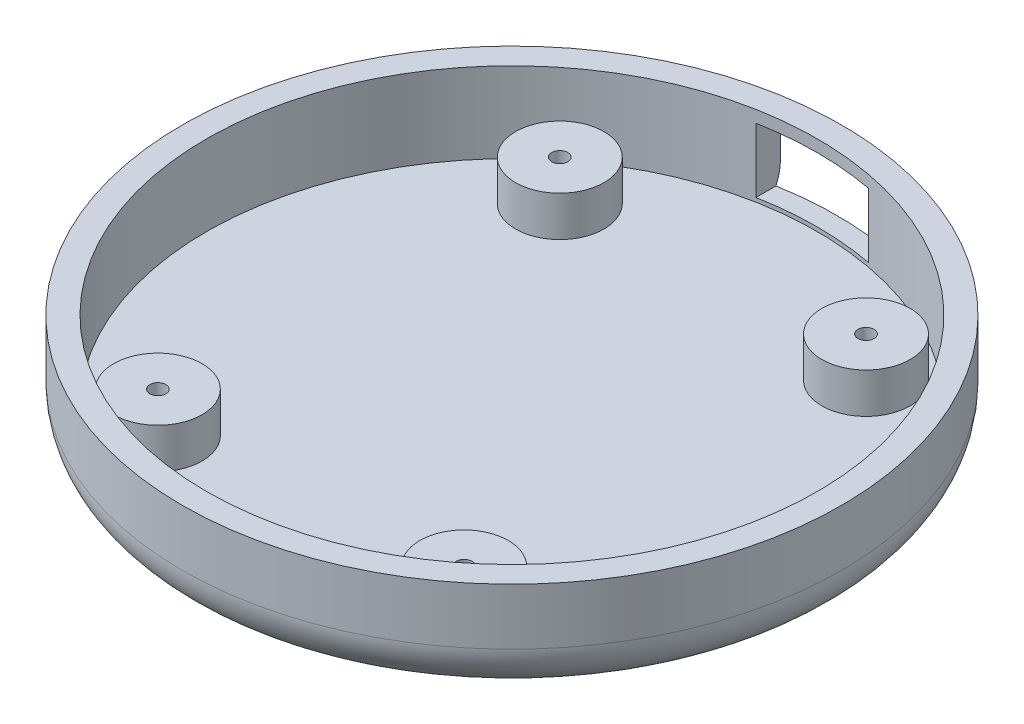
from build123d import *

# Parameters (mm, degrees)
SKETCH1_R           = 41
SKETCH1_R_2         = 2.5
BOSS_EXTRUDE1_DEPTH = 3
SKETCH3_R           = 41
SKETCH3_R_2         = 38
BOSS_EXTRUDE2_DEPTH = 10
SKETCH3_3_R         = 5.5
SKETCH3_3_R_2       = 2.5
BOSS_EXTRUDE3_DEPTH = 3
SKETCH4_R           = 5.5
SKETCH4_R_2         = 1
BOSS_EXTRUDE4_DEPTH = 2
FILLET1_R           = 6
SKETCH6_W           = 14
SKETCH6_H           = 8
CUT_EXTRUDE1_DEPTH  = 60.422218067


with BuildPart() as part:
    # Sketch1 → Boss-Extrude1 (new body)
    with BuildSketch(Plane(origin=(0, 0, 0), x_dir=(1, 0, 0), z_dir=(0, 1, 0))):
        Circle(SKETCH1_R)
        with Locations((-19.05, 25)):
            Circle(SKETCH1_R_2, mode=Mode.SUBTRACT)
        with Locations((19.05, 25)):
            Circle(SKETCH1_R_2, mode=Mode.SUBTRACT)
        with Locations((19.05, -25)):
            Circle(SKETCH1_R_2, mode=Mode.SUBTRACT)
        with Locations((-19.05, -25)):
            Circle(SKETCH1_R_2, mode=Mode.SUBTRACT)
    extrude(amount=BOSS_EXTRUDE1_DEPTH)

    # Sketch3 → Boss-Extrude2 (add)
    with BuildSketch(Plane(origin=(0, 3, 0), x_dir=(1, 0, 0), z_dir=(0, 1, 0))):
        Circle(SKETCH3_R)
        Circle(SKETCH3_R_2, mode=Mode.SUBTRACT)
    extrude(amount=BOSS_EXTRUDE2_DEPTH)

    # Sketch3<3> → Boss-Extrude3 (add)
    # profile 1 of 4: a face of its own
    with BuildSketch(Plane(origin=(0, 3, 0), x_dir=(1, 0, 0), z_dir=(0, 1, 0))):
        with Locations((-19.05, 25)):
            Circle(SKETCH3_3_R)
        with Locations((-19.05, 25)):
            Circle(SKETCH3_3_R_2, mode=Mode.SUBTRACT)
    # profile 2 of 4: a face of its own
    with BuildSketch(Plane(origin=(0, 3, 0), x_dir=(1, 0, 0), z_dir=(0, 1, 0))):
        with Locations((19.05, 25)):
            Circle(SKETCH3_3_R)
        with Locations((19.05, 25)):
            Circle(SKETCH3_3_R_2, mode=Mode.SUBTRACT)
    # profile 3 of 4: a face of its own
    with BuildSketch(Plane(origin=(0, 3, 0), x_dir=(1, 0, 0), z_dir=(0, 1, 0))):
        with Locations((19.05, -25)):
            Circle(SKETCH3_3_R)
        with Locations((19.05, -25)):
            Circle(SKETCH3_3_R_2, mode=Mode.SUBTRACT)
    # profile 4 of 4: a face of its own
    with BuildSketch(Plane(origin=(0, 3, 0), x_dir=(1, 0, 0), z_dir=(0, 1, 0))):
        with Locations((-19.05, -25)):
            Circle(SKETCH3_3_R)
        with Locations((-19.05, -25)):
            Circle(SKETCH3_3_R_2, mode=Mode.SUBTRACT)
    extrude(amount=BOSS_EXTRUDE3_DEPTH)

    # Sketch4 → Boss-Extrude4 (add)
    # profile 1 of 4: a face of its own
    with BuildSketch(Plane(origin=(0, 6, 0), x_dir=(1, 0, 0), z_dir=(0, 1, 0))):
        with Locations((-19.05, 25)):
            Circle(SKETCH4_R)
        with Locations((-19.05, 25)):
            Circle(SKETCH4_R_2, mode=Mode.SUBTRACT)
    # profile 2 of 4: a face of its own
    with BuildSketch(Plane(origin=(0, 6, 0), x_dir=(1, 0, 0), z_dir=(0, 1, 0))):
        with Locations((19.05, 25)):
            Circle(SKETCH4_R)
        with Locations((19.05, 25)):
            Circle(SKETCH4_R_2, mode=Mode.SUBTRACT)
    # profile 3 of 4: a face of its own
    with BuildSketch(Plane(origin=(0, 6, 0), x_dir=(1, 0, 0), z_dir=(0, 1, 0))):
        with Locations((19.05, -25)):
            Circle(SKETCH4_R)
        with Locations((19.05, -25)):
            Circle(SKETCH4_R_2, mode=Mode.SUBTRACT)
    # profile 4 of 4: a face of its own
    with BuildSketch(Plane(origin=(0, 6, 0), x_dir=(1, 0, 0), z_dir=(0, 1, 0))):
        with Locations((-19.05, -25)):
            Circle(SKETCH4_R)
        with Locations((-19.05, -25)):
            Circle(SKETCH4_R_2, mode=Mode.SUBTRACT)
    extrude(amount=BOSS_EXTRUDE4_DEPTH)

    # Fillet1
    fillet1_edges = [part.edges().sort_by_distance(p)[0] for p in [
        (-41, 0, 0),
    ]]
    fillet(fillet1_edges, radius=FILLET1_R)

    # Sketch6 → Cut-Extrude1 (cut, through all)
    with BuildSketch(Plane.XY):
        with Locations((0, 7.5)):
            Rectangle(SKETCH6_W, SKETCH6_H)
    extrude(amount=-CUT_EXTRUDE1_DEPTH, mode=Mode.SUBTRACT)


solid = part.part
